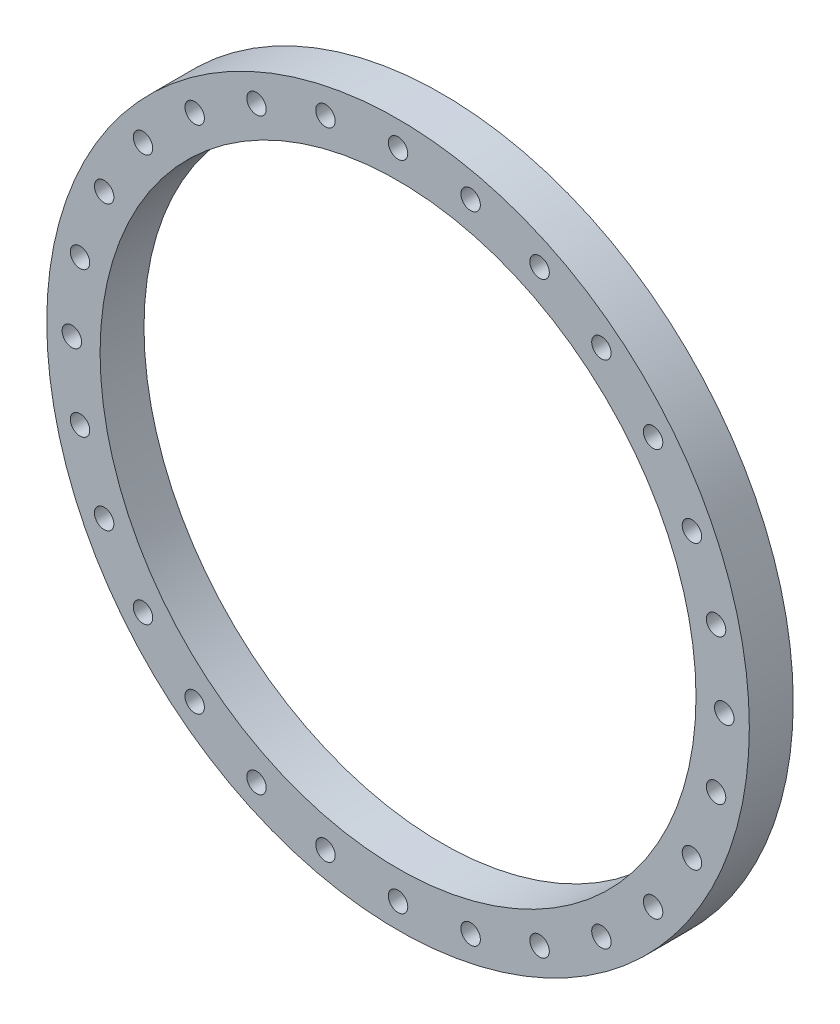
from build123d import *

# Parameters (mm, degrees)
SKETCH_1_R      = 56
SKETCH_1_R_2    = 47.5
SKETCH_1_R_3    = 1.55
EXTRUDE_1_DEPTH = 7


with BuildPart() as part:
    # 草图1 → 凸台-拉伸1 (new body)
    with BuildSketch(Plane.XY):
        Circle(SKETCH_1_R)
        Circle(SKETCH_1_R_2, mode=Mode.SUBTRACT)
        with Locations((0, 52)):
            Circle(SKETCH_1_R_3, mode=Mode.SUBTRACT)
        with Locations((11.571088566, 50.696251433)):
            Circle(SKETCH_1_R_3, mode=Mode.SUBTRACT)
        with Locations((22.561954434, 46.850381131)):
            Circle(SKETCH_1_R_3, mode=Mode.SUBTRACT)
        with Locations((32.421469697, 40.655237088)):
            Circle(SKETCH_1_R_3, mode=Mode.SUBTRACT)
        with Locations((40.655237088, 32.421469697)):
            Circle(SKETCH_1_R_3, mode=Mode.SUBTRACT)
        with Locations((46.850381131, 22.561954434)):
            Circle(SKETCH_1_R_3, mode=Mode.SUBTRACT)
        with Locations((50.696251433, 11.571088566)):
            Circle(SKETCH_1_R_3, mode=Mode.SUBTRACT)
        with Locations((52, 0)):
            Circle(SKETCH_1_R_3, mode=Mode.SUBTRACT)
        with Locations((50.696251433, -11.571088566)):
            Circle(SKETCH_1_R_3, mode=Mode.SUBTRACT)
        with Locations((46.850381131, -22.561954434)):
            Circle(SKETCH_1_R_3, mode=Mode.SUBTRACT)
        with Locations((40.655237088, -32.421469697)):
            Circle(SKETCH_1_R_3, mode=Mode.SUBTRACT)
        with Locations((32.421469697, -40.655237088)):
            Circle(SKETCH_1_R_3, mode=Mode.SUBTRACT)
        with Locations((22.561954434, -46.850381131)):
            Circle(SKETCH_1_R_3, mode=Mode.SUBTRACT)
        with Locations((11.571088566, -50.696251433)):
            Circle(SKETCH_1_R_3, mode=Mode.SUBTRACT)
        with Locations((0, -52)):
            Circle(SKETCH_1_R_3, mode=Mode.SUBTRACT)
        with Locations((-11.571088566, -50.696251433)):
            Circle(SKETCH_1_R_3, mode=Mode.SUBTRACT)
        with Locations((-22.561954434, -46.850381131)):
            Circle(SKETCH_1_R_3, mode=Mode.SUBTRACT)
        with Locations((-32.421469697, -40.655237088)):
            Circle(SKETCH_1_R_3, mode=Mode.SUBTRACT)
        with Locations((-40.655237088, -32.421469697)):
            Circle(SKETCH_1_R_3, mode=Mode.SUBTRACT)
        with Locations((-46.850381131, -22.561954434)):
            Circle(SKETCH_1_R_3, mode=Mode.SUBTRACT)
        with Locations((-50.696251433, -11.571088566)):
            Circle(SKETCH_1_R_3, mode=Mode.SUBTRACT)
        with Locations((-52, 0)):
            Circle(SKETCH_1_R_3, mode=Mode.SUBTRACT)
        with Locations((-50.696251433, 11.571088566)):
            Circle(SKETCH_1_R_3, mode=Mode.SUBTRACT)
        with Locations((-46.850381131, 22.561954434)):
            Circle(SKETCH_1_R_3, mode=Mode.SUBTRACT)
        with Locations((-40.655237088, 32.421469697)):
            Circle(SKETCH_1_R_3, mode=Mode.SUBTRACT)
        with Locations((-32.421469697, 40.655237088)):
            Circle(SKETCH_1_R_3, mode=Mode.SUBTRACT)
        with Locations((-22.561954434, 46.850381131)):
            Circle(SKETCH_1_R_3, mode=Mode.SUBTRACT)
        with Locations((-11.571088566, 50.696251433)):
            Circle(SKETCH_1_R_3, mode=Mode.SUBTRACT)
    extrude(amount=EXTRUDE_1_DEPTH)


solid = part.part
